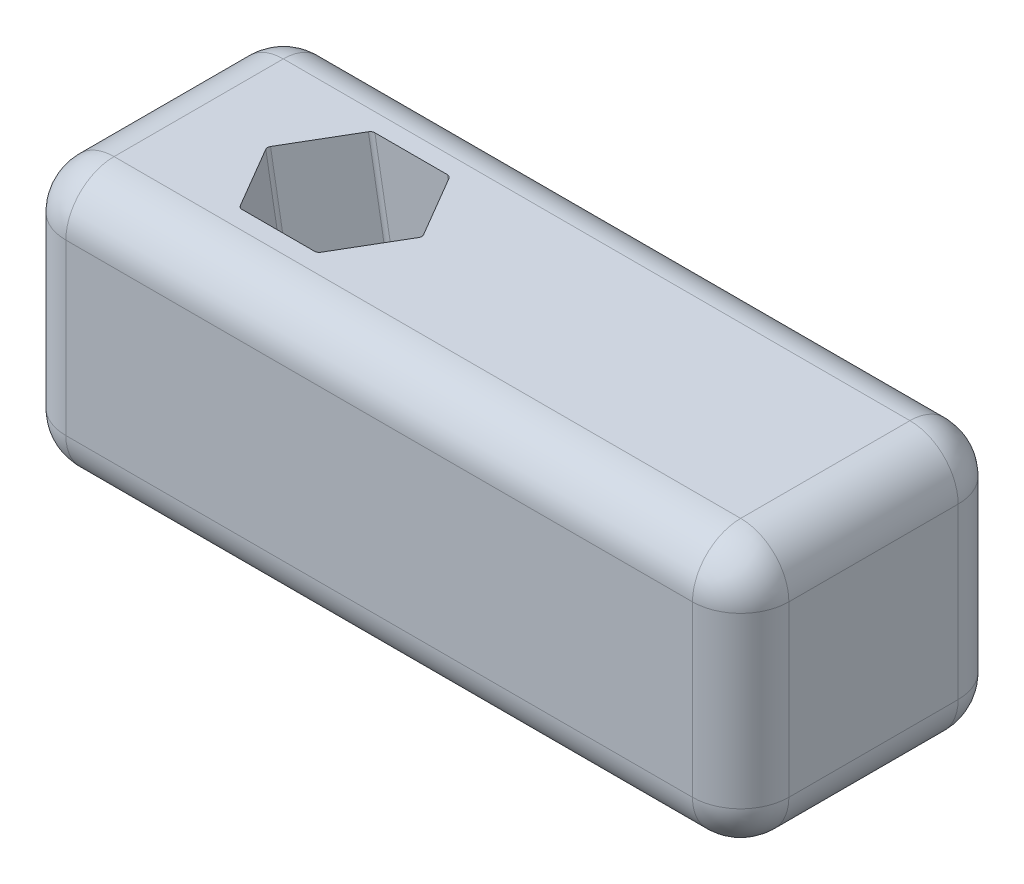
from build123d import *

# Parameters (mm, degrees)
SKETCH1_W           = 38.1
SKETCH1_H           = 14
BOSS_EXTRUDE1_DEPTH = 7
FILLET1_R           = 2.54
CUT_EXTRUDE1_DEPTH  = 12.7
FILLET2_R           = 1
FILLET3_R           = 0.25


with BuildPart() as part:
    # Sketch1 → Boss-Extrude1 (new, symmetric)
    with BuildSketch(Plane.XY):
        with Locations((19.05, 7)):
            Rectangle(SKETCH1_W, SKETCH1_H)
    extrude(amount=BOSS_EXTRUDE1_DEPTH, both=True)

    # Fillet1
    fillet1_edges = [part.edges().sort_by_distance(p)[0] for p in [
        (38.1, 7, 7),
        (19.05, 14, 7),
        (0, 7, 7),
        (19.05, 14, -7),
        (38.1, 7, -7),
        (19.05, 0, -7),
        (0, 7, -7),
        (19.05, 0, 7),
        (0, 14, 0),
        (38.1, 14, 0),
        (38.1, 0, 0),
        (0, 0, 0),
    ]]
    fillet(fillet1_edges, radius=FILLET1_R)

    # Sketch3 → Cut-Extrude1 (cut)
    with BuildSketch(Plane(origin=(-2.317550632, 13.143482763, 0), x_dir=(0.9848077530122074, 0.1736481776669347, 0), z_dir=(-0.17364817766693472, 0.9848077530122075, 0))):
        Polygon((16.548510348, 0), (14.527784405, 3.5), (10.486332521, 3.5), (8.465606579, 0), (10.486332521, -3.5), (14.527784405, -3.5), align=None)
    extrude(amount=-CUT_EXTRUDE1_DEPTH, mode=Mode.SUBTRACT)

    # Fillet2
    fillet2_edges = [part.edges().sort_by_distance(p)[0] for p in [
        (15.189869229, 3.334595276, 1.75),
        (12.204829367, 2.80825221, 3.5),
        (9.219789505, 2.281909144, 1.75),
        (9.219789505, 2.281909144, -1.75),
        (12.204829367, 2.80825221, -3.5),
        (15.189869229, 3.334595276, -1.75),
    ]]
    fillet(fillet2_edges, radius=FILLET2_R)

    # Fillet3
    fillet3_edges = [part.edges().sort_by_distance(p)[0] for p in [
        (13.152264465, 9.07197767, 3.5),
        (9.110338994, 8.721082293, 3.5),
        (7.089376258, 8.545634604, 0),
        (9.110338994, 8.721082293, -3.5),
        (13.152264465, 9.07197767, -3.5),
        (15.173227201, 9.247425359, 0),
        (10.349377707, 2.753337988, -3.181429078),
        (13.96716537, 3.391251564, -3.181429078),
        (8.540483876, 2.434381201, 0),
        (15.776059261, 3.71020842, 0),
        (10.349377707, 2.753337988, 3.181429078),
        (13.96716537, 3.391251564, 3.181429078),
    ]]
    fillet(fillet3_edges, radius=FILLET3_R)


solid = part.part
